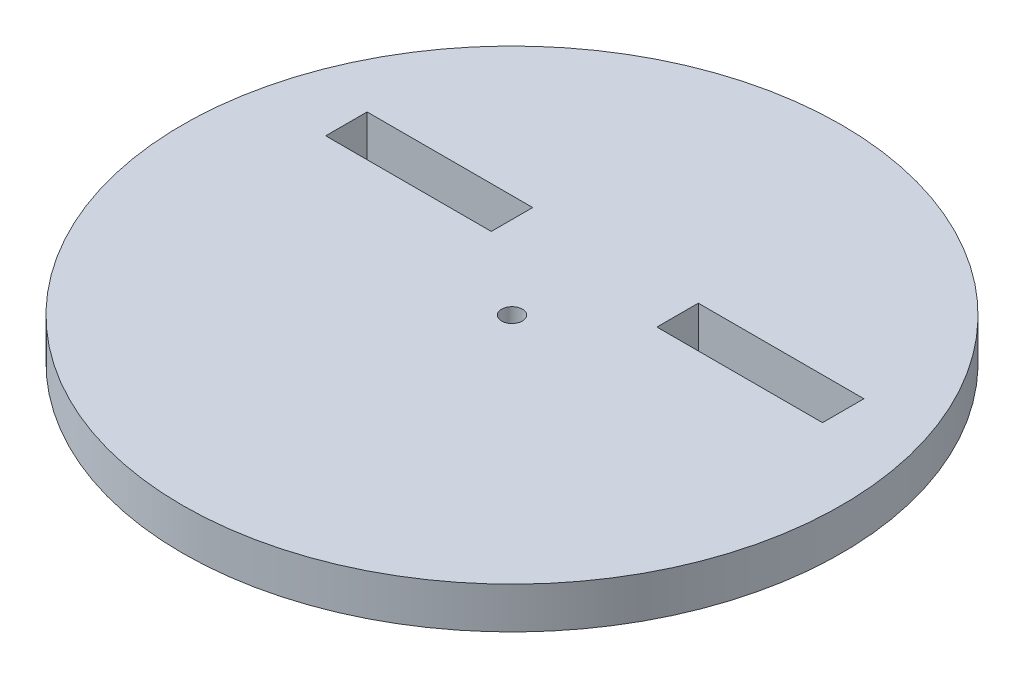
from build123d import *

# Parameters (mm, degrees)
SKETCH1_R           = 50.546
SKETCH1_R_2         = 1.5875
SKETCH1_W           = 25.4
SKETCH1_H           = 6.35
BOSS_EXTRUDE1_DEPTH = 6.35


with BuildPart() as part:
    # Sketch1 → Boss-Extrude1 (new body)
    with BuildSketch(Plane(origin=(0, 0, 0), x_dir=(1, 0, 0), z_dir=(0, 1, 0))):
        with Locations(Location((0, 0, 0), (0, 0, 270))):
            Circle(SKETCH1_R)
        with Locations(Location((0, 0, 0), (0, 0, 270))):
            Circle(SKETCH1_R_2, mode=Mode.SUBTRACT)
        with Locations((-25.4, 12.7)):
            Rectangle(SKETCH1_W, SKETCH1_H, mode=Mode.SUBTRACT)
        with Locations((25.4, 12.7)):
            Rectangle(SKETCH1_W, SKETCH1_H, mode=Mode.SUBTRACT)
    extrude(amount=BOSS_EXTRUDE1_DEPTH)


solid = part.part
